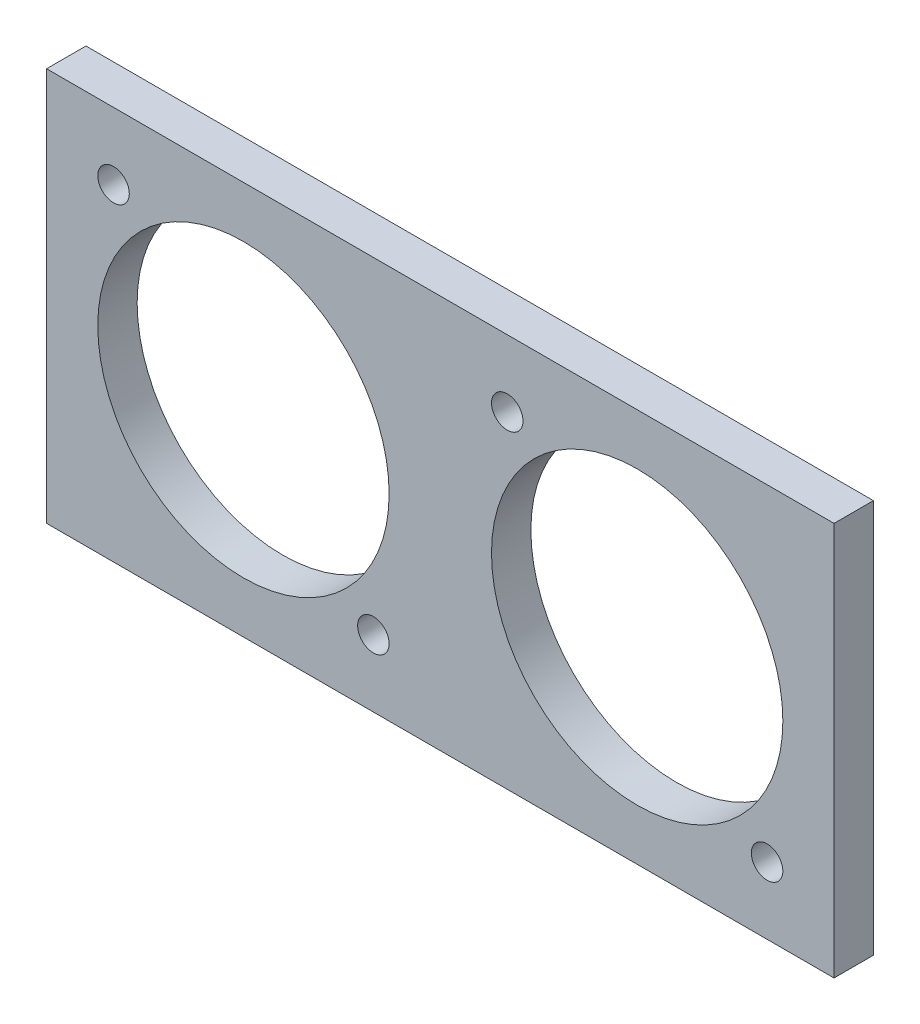
from build123d import *

# Parameters (mm, degrees)
ESQUISSE1_W             = 60
ESQUISSE1_H             = 30
BOSS_EXTRU_1_DEPTH      = 3
ESQUISSE2_R             = 11.1
ESQUISSE2_R_2           = 1.2
ENL_V_MAT_EXTRU_1_DEPTH = 68.149087857


with BuildPart() as part:
    # Esquisse1 → Boss.-Extru.1 (new body)
    with BuildSketch(Plane.XY):
        with Locations((30, 15)):
            Rectangle(ESQUISSE1_W, ESQUISSE1_H)
    extrude(amount=BOSS_EXTRU_1_DEPTH)

    # Esquisse2 → Enlèv. mat.-Extru.1 (cut, through all)
    with BuildSketch(Plane.XY.offset(3)):
        with Locations((15, 15)):
            Circle(ESQUISSE2_R)
        with Locations((45, 15)):
            Circle(ESQUISSE2_R)
        with Locations((5.100505063, 24.899494937)):
            Circle(ESQUISSE2_R_2)
        with Locations((24.899494937, 5.100505063)):
            Circle(ESQUISSE2_R_2)
        with Locations((35.100505063, 24.899494937)):
            Circle(ESQUISSE2_R_2)
        with Locations((54.899494937, 5.100505063)):
            Circle(ESQUISSE2_R_2)
    extrude(amount=-ENL_V_MAT_EXTRU_1_DEPTH, mode=Mode.SUBTRACT)


solid = part.part
